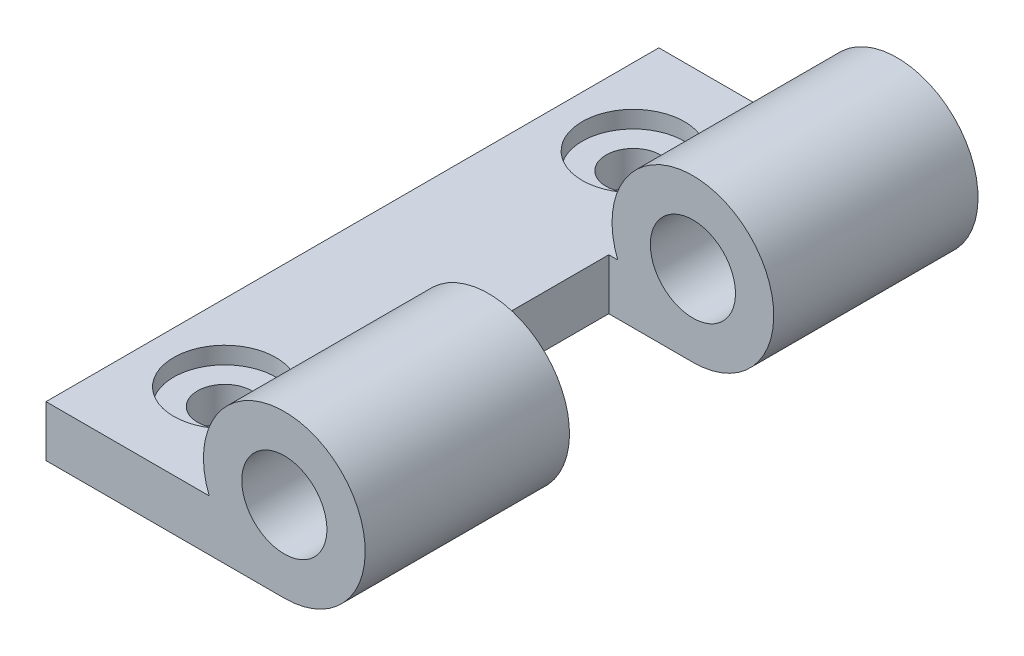
from build123d import *

# Parameters (mm, degrees)
SKETCH_1_W          = 14
SKETCH_1_H          = 36
EXTRUDE_1_DEPTH     = 3
SKETCH_2_R          = 4.75
EXTRUDE_2_DEPTH     = 12
EXTRUDE_START       = -12
SKETCH_3_R          = 4.75
EXTRUDE_3_DEPTH     = 12
SKETCH_4_R          = 2.5
CUT_EXTRUDE_1_DEPTH = 51
SKETCH_5_W          = 8.893722196
SKETCH_5_H          = 10.697157082
CUT_EXTRUDE_2_DEPTH = 12
SKETCH_6_R          = 1.6
CUT_EXTRUDE_3_DEPTH = 10
SKETCH_7_R          = 3
CUT_EXTRUDE_4_DEPTH = 1


with BuildPart() as part:
    # 草图1 → 凸台-拉伸1 (new body)
    with BuildSketch(Plane(origin=(0, 0, 0), x_dir=(1, 0, 0), z_dir=(0, 1, 0))):
        with Locations((7, -18)):
            Rectangle(SKETCH_1_W, SKETCH_1_H)
    extrude(amount=EXTRUDE_1_DEPTH)

    # 草图2 → 凸台-拉伸2 (add)
    with BuildSketch(Plane(origin=(0, 0, 0), x_dir=(-1, 0, 0), z_dir=(0, 0, -1))):
        with Locations((-14, 4.75)):
            Circle(SKETCH_2_R)
    extrude(amount=-EXTRUDE_2_DEPTH)

    # 草图3 → 凸台-拉伸3 (add)
    with BuildSketch(Plane.XY.offset(36).offset(EXTRUDE_START)):
        with Locations((14, 4.75)):
            Circle(SKETCH_3_R)
    extrude(amount=EXTRUDE_3_DEPTH)

    # 草图4 → 切除-拉伸1 (cut)
    with BuildSketch(Plane(origin=(0, 0, 0), x_dir=(-1, 0, 0), z_dir=(0, 0, -1))):
        with Locations((-14, 4.75)):
            Circle(SKETCH_4_R)
    extrude(amount=-CUT_EXTRUDE_1_DEPTH, mode=Mode.SUBTRACT)

    # 草图5 → 切除-拉伸2 (cut)
    with BuildSketch(Plane(origin=(0, 0, 24), x_dir=(-1, 0, 0), z_dir=(0, 0, -1))):
        with Locations((-13.504665101, 2.655560542)):
            Rectangle(SKETCH_5_W, SKETCH_5_H)
    extrude(amount=CUT_EXTRUDE_2_DEPTH, mode=Mode.SUBTRACT)

    # 草图6 → 切除-拉伸3 (cut)
    with BuildSketch(Plane(origin=(0, 3, 0), x_dir=(1, 0, 0), z_dir=(0, 1, 0))):
        with Locations(Location((4.5, -6, 0), (0, 0, 270))):
            Circle(SKETCH_6_R)
        with Locations(Location((4.5, -30, 0), (0, 0, 270))):
            Circle(SKETCH_6_R)
    extrude(amount=-CUT_EXTRUDE_3_DEPTH, mode=Mode.SUBTRACT)

    # 草图7 → 切除-拉伸4 (cut)
    with BuildSketch(Plane(origin=(0, 3, 0), x_dir=(1, 0, 0), z_dir=(0, 1, 0))):
        with Locations(Location((4.5, -6, 0), (0, 0, 270))):
            Circle(SKETCH_7_R)
        with Locations(Location((4.5, -30, 0), (0, 0, 270))):
            Circle(SKETCH_7_R)
    extrude(amount=-CUT_EXTRUDE_4_DEPTH, mode=Mode.SUBTRACT)


solid = part.part
